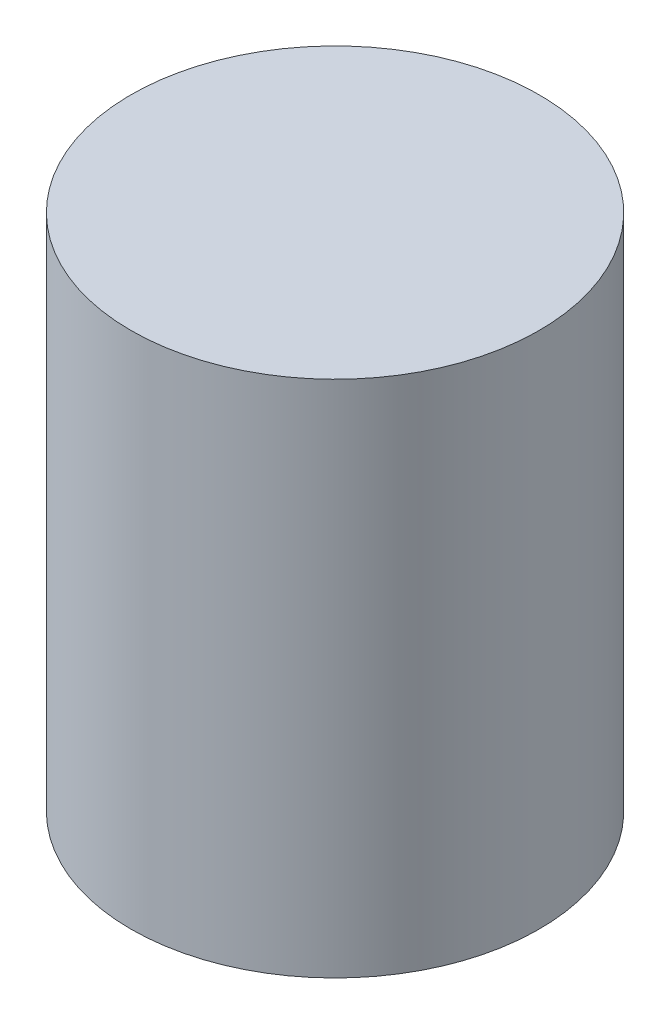
from build123d import *

# Parameters (mm, degrees)
SKETCH1_R           = 25
BOSS_EXTRUDE1_DEPTH = 63.5


with BuildPart() as part:
    # Sketch1 → Boss-Extrude1 (new body)
    with BuildSketch(Plane(origin=(0, 0, 0), x_dir=(1, 0, 0), z_dir=(0, 1, 0))):
        with Locations(Location((0, 0, 0), (0, 0, 270))):
            Circle(SKETCH1_R)
    extrude(amount=BOSS_EXTRUDE1_DEPTH)


solid = part.part
